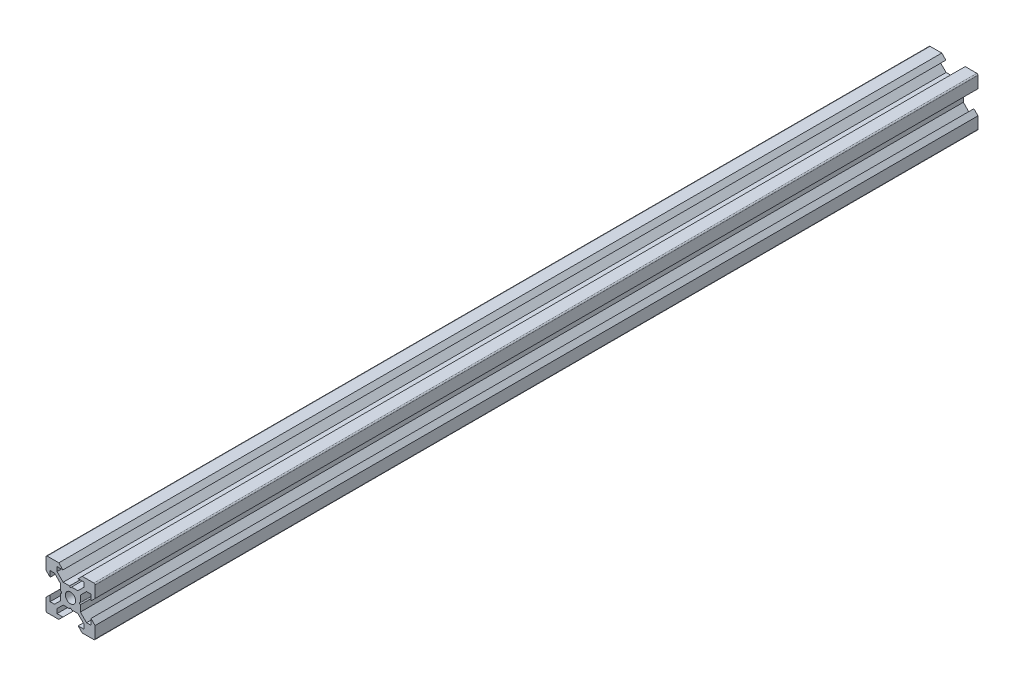
from build123d import *

# Parameters (mm, degrees)
SKETCH1_R           = 2.1
BOSS_EXTRUDE1_DEPTH = 360
FILLET1_R           = 0.5
CUT_EXTRUDE1_DEPTH  = 361.277670693


with BuildPart() as part:
    # Sketch1 → Boss-Extrude1 (new body)
    with BuildSketch(Plane.XY):
        Polygon((-10, 10), (-4.775, 10), (-3.1, 8.325), (-5.5, 8.325), (-5.5, 6.525), (-3, 4.025), (3, 4.025), (5.5, 6.525), (5.5, 8.325), (3.1, 8.325), (4.775, 10), (10, 10), (10, 4.775), (8.325, 3.1), (8.325, 5.5), (6.525, 5.5), (4.025, 3), (4.025, -3), (6.525, -5.5), (8.325, -5.5), (8.325, -3.1), (10, -4.775), (10, -10), (4.775, -10), (3.1, -8.325), (5.5, -8.325), (5.5, -6.525), (3, -4.025), (-3, -4.025), (-5.5, -6.525), (-5.5, -8.325), (-3.1, -8.325), (-4.775, -10), (-10, -10), (-10, -4.775), (-8.325, -3.1), (-8.325, -5.5), (-6.525, -5.5), (-4.025, -3), (-4.025, 3), (-6.525, 5.5), (-8.325, 5.5), (-8.325, 3.1), (-10, 4.775), align=None)
        with Locations(Location((0, 0, 0), (0, 0, 180))):
            Circle(SKETCH1_R, mode=Mode.SUBTRACT)
    extrude(amount=BOSS_EXTRUDE1_DEPTH)

    # Fillet1
    fillet1_edges = [part.edges().sort_by_distance(p)[0] for p in [
        (10, -10, 180),
        (-10, -10, 180),
        (-10, 10, 180),
        (10, 10, 180),
    ]]
    fillet(fillet1_edges, radius=FILLET1_R)

    # Sketch2 → Cut-Extrude1 (cut, through all)
    with BuildSketch(Plane.XY.offset(360)):
        with BuildLine():
            ThreePointArc((-4.025, 0.4), (-4.425, 0), (-4.025, -0.4))
            Line((-4.025, -0.4), (-4.025, 0.4))
        make_face()
        with BuildLine():
            Line((-4.025, 0.4), (-4.025, -0.4))
            ThreePointArc((-4.025, -0.4), (-3.742157288, -0.282842712), (-3.625, 0))
            ThreePointArc((-3.625, 0), (-3.742157288, 0.282842712), (-4.025, 0.4))
        make_face()
        with BuildLine():
            ThreePointArc((0.4, 4.025), (0, 4.425), (-0.4, 4.025))
            Line((-0.4, 4.025), (0.4, 4.025))
        make_face()
        with BuildLine():
            Line((0.4, 4.025), (-0.4, 4.025))
            ThreePointArc((-0.4, 4.025), (0, 3.625), (0.4, 4.025))
        make_face()
        with BuildLine():
            ThreePointArc((4.025, 0.4), (3.625, 0), (4.025, -0.4))
            Line((4.025, -0.4), (4.025, 0.4))
        make_face()
        with BuildLine():
            Line((4.025, 0.4), (4.025, -0.4))
            ThreePointArc((4.025, -0.4), (4.307842712, -0.282842712), (4.425, 0))
            ThreePointArc((4.425, 0), (4.307842712, 0.282842712), (4.025, 0.4))
        make_face()
        with BuildLine():
            ThreePointArc((0.4, -4.025), (0, -3.625), (-0.4, -4.025))
            Line((-0.4, -4.025), (0.4, -4.025))
        make_face()
        with BuildLine():
            Line((0.4, -4.025), (-0.4, -4.025))
            ThreePointArc((-0.4, -4.025), (0, -4.425), (0.4, -4.025))
        make_face()
    extrude(amount=-CUT_EXTRUDE1_DEPTH, mode=Mode.SUBTRACT)


solid = part.part
